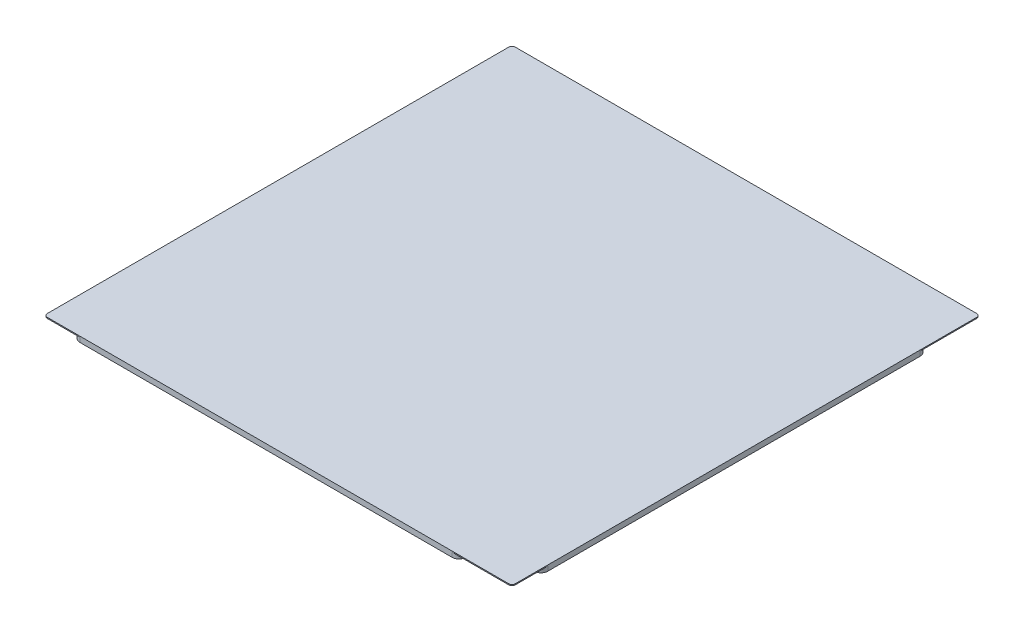
from build123d import *

# Parameters (mm, degrees)
SKETCH1_W           = 137
SKETCH1_H           = 137
BOSS_EXTRUDE1_DEPTH = 0.15
SKETCH2_W           = 13.5
SKETCH2_H           = 113
SKETCH2_W_2         = 113
SKETCH2_H_2         = 13.5
BOSS_EXTRUDE2_DEPTH = 1.3
FILLET1_R           = 2
FILLET2_R           = 1


with BuildPart() as part:
    # Sketch1 → Boss-Extrude1 (new, symmetric)
    with BuildSketch(Plane(origin=(0, 0, 0), x_dir=(1, 0, 0), z_dir=(0, 1, 0))):
        Rectangle(SKETCH1_W, SKETCH1_H)
    extrude(amount=BOSS_EXTRUDE1_DEPTH, both=True)

    # Sketch2 → Boss-Extrude2 (add)
    with BuildSketch(Plane.XZ.offset(0.15)):
        with Locations((-61.75, -3.5)):
            Rectangle(SKETCH2_W, SKETCH2_H)
        with Locations((3.5, -61.75)):
            Rectangle(SKETCH2_W_2, SKETCH2_H_2)
        with Locations((-3.5, 61.75)):
            Rectangle(SKETCH2_W_2, SKETCH2_H_2)
        with Locations((61.75, 3.5)):
            Rectangle(SKETCH2_W, SKETCH2_H)
    extrude(amount=BOSS_EXTRUDE2_DEPTH)

    # Fillet1
    fillet1_edges = [part.edges().sort_by_distance(p)[0] for p in [
        (60, -0.8, -68.5),
        (60, -0.8, -55),
        (-53, -0.8, -55),
        (-53, -0.8, -68.5),
        (-55, -0.8, -60),
        (-55, -0.8, 53),
        (-68.5, -0.8, 53),
        (-68.5, -0.8, -60),
        (-60, -0.8, 55),
        (53, -0.8, 55),
        (53, -0.8, 68.5),
        (-60, -0.8, 68.5),
        (55, -0.8, 60),
        (55, -0.8, -53),
        (68.5, -0.8, -53),
        (68.5, -0.8, 60),
    ]]
    fillet(fillet1_edges, radius=FILLET1_R)

    # Fillet2
    fillet2_edges = [part.edges().sort_by_distance(p)[0] for p in [
        (68.5, 0, 68.5),
        (-68.5, 0, 68.5),
        (-68.5, 0, -68.5),
        (68.5, 0, -68.5),
    ]]
    fillet(fillet2_edges, radius=FILLET2_R)


solid = part.part
